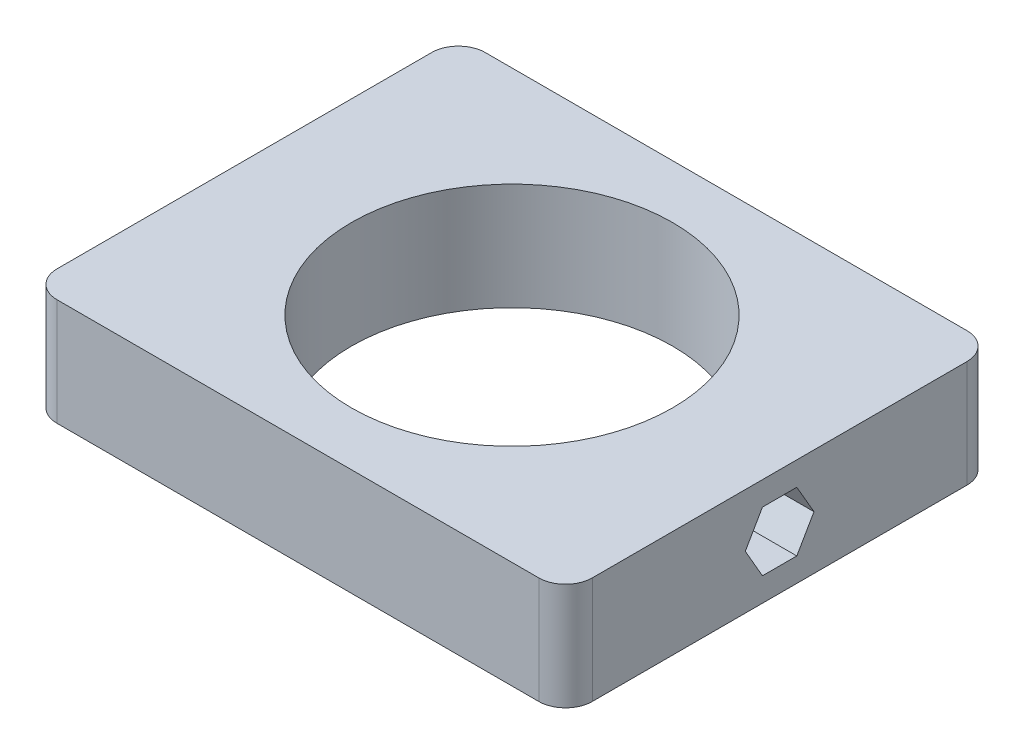
from build123d import *

# Parameters (mm, degrees)
SKETCH1_R               = 38.1
BOSS_EXTRUDE1_DEPTH     = 25.4
CUT_EXTRUDE1_REACH      = 141.122
CUT_EXTRUDE1_END_RADIUS = 38.1
CUT_EXTRUDE3_DEPTH      = 6.35


with BuildPart() as part:
    # Sketch1 → Boss-Extrude1 (new body)
    with BuildSketch(Plane(origin=(0, 0, 0), x_dir=(1, 0, 0), z_dir=(0, 1, 0))):
        with BuildLine():
            Line((-57.15, 50.8), (57.15, 50.8))
            ThreePointArc((57.15, 50.8), (61.640128061, 48.940128061), (63.5, 44.45))
            Line((63.5, 44.45), (63.5, -44.45))
            ThreePointArc((63.5, -44.45), (61.640128061, -48.940128061), (57.15, -50.8))
            Line((57.15, -50.8), (-57.15, -50.8))
            ThreePointArc((-57.15, -50.8), (-61.640128061, -48.940128061), (-63.5, -44.45))
            Line((-63.5, -44.45), (-63.5, 44.45))
            ThreePointArc((-63.5, 44.45), (-61.640128061, 48.940128061), (-57.15, 50.8))
        make_face()
        with Locations(Location((0, 0, 0), (0, 0, 270))):
            Circle(SKETCH1_R, mode=Mode.SUBTRACT)
    extrude(amount=BOSS_EXTRUDE1_DEPTH)

    # Cut-Extrude1: up to this cylinder (the profile starts outside it)
    cut_extrude1_end = Plane(origin=(0, 12.7, 0), z_dir=(0, -1, 0)) * Cylinder(CUT_EXTRUDE1_END_RADIUS, 359.444, mode=Mode.PRIVATE)
    # Sketch2 → Cut-Extrude1 (cut, up to the surface)
    with BuildSketch(Plane(origin=(63.5, 0, 0), x_dir=(0, 0, -1), z_dir=(1, 0, 0)), mode=Mode.PRIVATE) as cut_extrude1_sk1:
        Polygon((8.146406132, 12.7), (4.073203066, 19.75499466), (-4.073203066, 19.75499466), (-8.146406132, 12.7), (-4.073203066, 5.64500534), (4.073203066, 5.64500534), align=None)
    cut_extrude1_tool1 = extrude(cut_extrude1_sk1.sketch, amount=-CUT_EXTRUDE1_REACH, mode=Mode.PRIVATE) - cut_extrude1_end
    add(cut_extrude1_tool1.solids().sort_by_distance((63.5, 12.7, 0))[0], mode=Mode.SUBTRACT)

    # Sketch3 → Cut-Extrude3 (cut)
    with BuildSketch(Plane(origin=(0, 0, -50.8), x_dir=(-1, 0, 0), z_dir=(0, 0, -1))):
        Polygon((0, 22.327483366), (10.590327972, 3.984497249), (-10.590327972, 3.984497249), align=None)
    extrude(amount=-CUT_EXTRUDE3_DEPTH, mode=Mode.SUBTRACT)


solid = part.part
